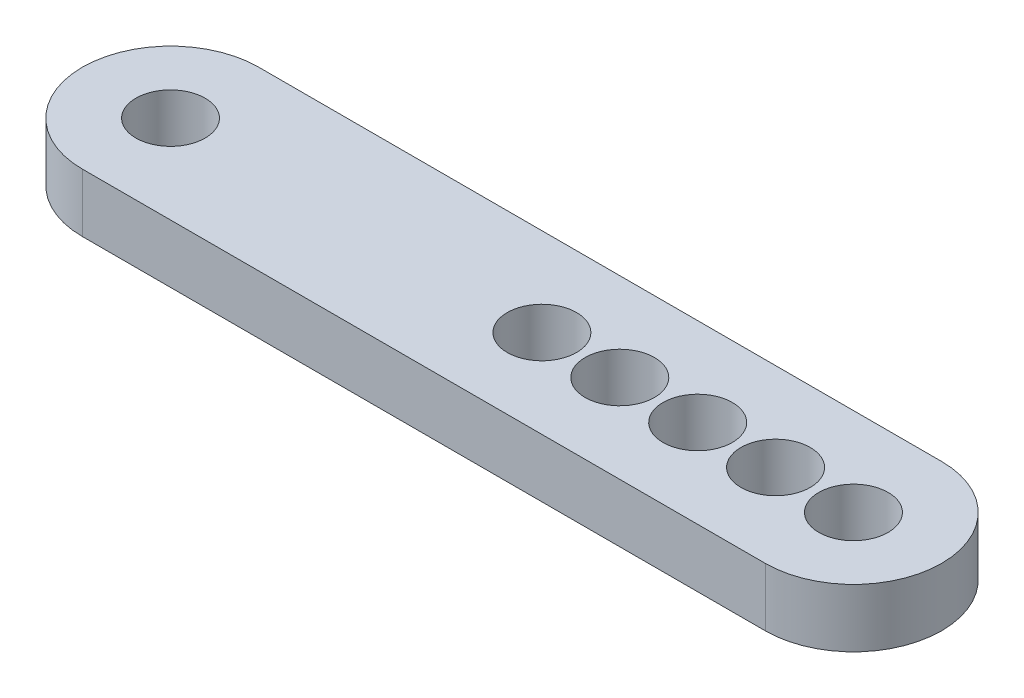
from build123d import *

# Parameters (mm, degrees)
SKETCH1_R           = 1.778
SKETCH1_R_2         = 1.78
BOSS_EXTRUDE1_DEPTH = 3


with BuildPart() as part:
    # Sketch1 → Boss-Extrude1 (new body)
    with BuildSketch(Plane(origin=(0, 0, 0), x_dir=(1, 0, 0), z_dir=(0, 1, 0))):
        with BuildLine():
            Line((0, 4.53), (35.07, 4.53))
            ThreePointArc((35.07, 4.53), (39.6, 0), (35.07, -4.53))
            Line((35.07, -4.53), (0, -4.53))
            ThreePointArc((0, -4.53), (-4.53, 0), (0, 4.53))
        make_face()
        with Locations(Location((0, 0, 0), (0, 0, 270))):
            Circle(SKETCH1_R, mode=Mode.SUBTRACT)
        with Locations(Location((27.07, 0, 0), (0, 0, 270))):
            Circle(SKETCH1_R_2, mode=Mode.SUBTRACT)
        with Locations(Location((31.07, 0, 0), (0, 0, 270))):
            Circle(SKETCH1_R_2, mode=Mode.SUBTRACT)
        with Locations(Location((35.07, 0, 0), (0, 0, 270))):
            Circle(SKETCH1_R_2, mode=Mode.SUBTRACT)
        with Locations(Location((23.07, 0, 0), (0, 0, 270))):
            Circle(SKETCH1_R_2, mode=Mode.SUBTRACT)
        with Locations(Location((19.07, 0, 0), (0, 0, 270))):
            Circle(SKETCH1_R_2, mode=Mode.SUBTRACT)
    extrude(amount=BOSS_EXTRUDE1_DEPTH)


solid = part.part
